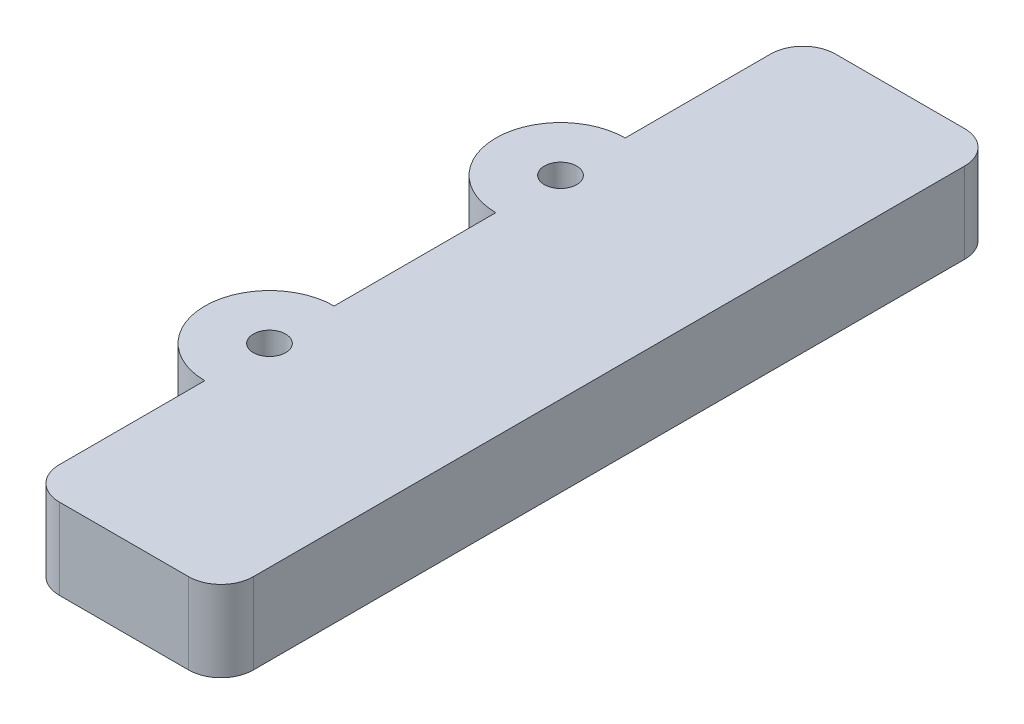
from build123d import *

# Parameters (mm, degrees)
SKETCH1_R           = 1
BOSS_EXTRUDE1_DEPTH = 5
FILLET2_R           = 2


with BuildPart() as part:
    # Sketch1 → Boss-Extrude1 (new body)
    with BuildSketch(Plane(origin=(0, 0, 0), x_dir=(1, 0, 0), z_dir=(0, 1, 0))):
        with BuildLine():
            Line((0, 0), (12, 0))
            Line((12, 0), (12, 48))
            Line((12, 48), (0, 48))
            Line((0, 48), (0, 37))
            ThreePointArc((0, 37), (-4, 33), (0, 29))
            Line((0, 29), (0, 19))
            ThreePointArc((0, 19), (-4, 15), (0, 11))
            Line((0, 11), (0, 0))
        make_face()
        with Locations(Location((0, 33, 0), (0, 0, 270))):
            Circle(SKETCH1_R, mode=Mode.SUBTRACT)
        with Locations(Location((0, 15, 0), (0, 0, 270))):
            Circle(SKETCH1_R, mode=Mode.SUBTRACT)
    extrude(amount=BOSS_EXTRUDE1_DEPTH)

    # Fillet2
    fillet2_edges = [part.edges().sort_by_distance(p)[0] for p in [
        (12, 2.5, 0),
        (0, 2.5, 0),
        (0, 2.5, -48),
        (12, 2.5, -48),
    ]]
    fillet(fillet2_edges, radius=FILLET2_R)


solid = part.part
